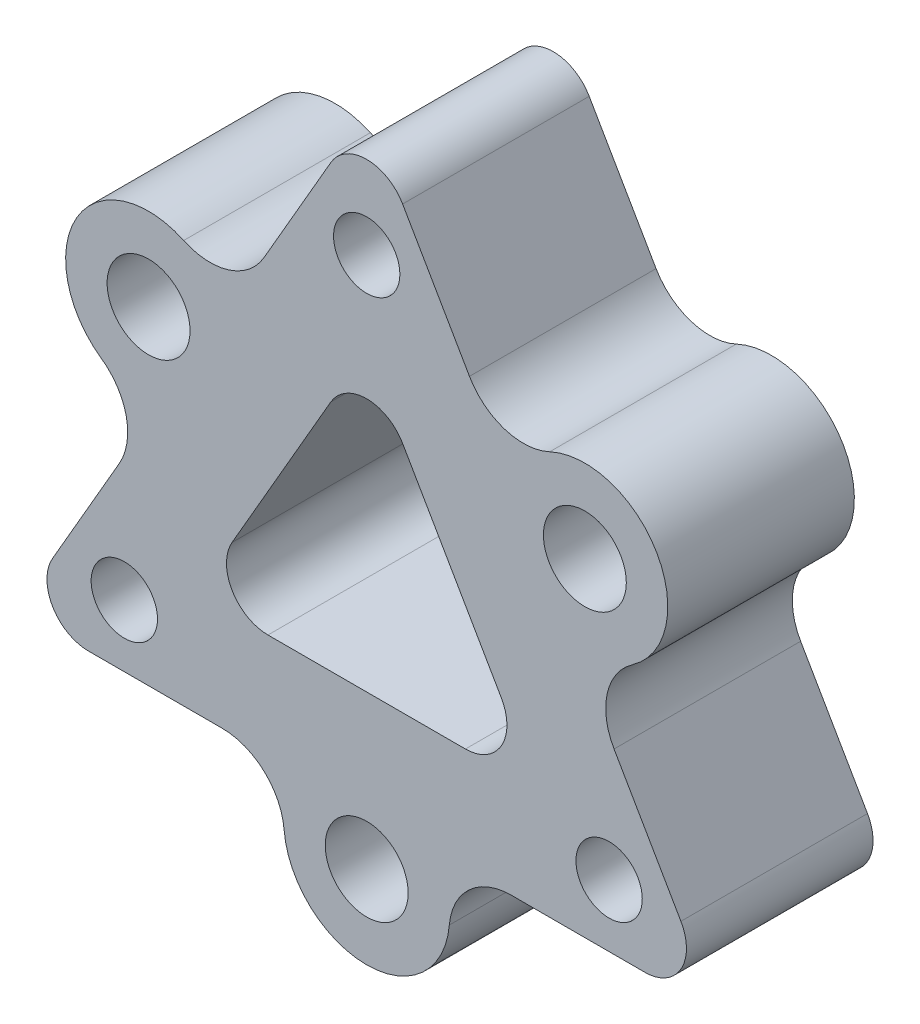
from build123d import *

# Parameters (mm, degrees)
SKETCH_1_R      = 1.6
EXTRUDE_1_DEPTH = 9
FILLET_1_R      = 2
SKETCH_2_R      = 4
SKETCH_2_R_2    = 2
EXTRUDE_2_DEPTH = 9
FILLET_2_R      = 3


with BuildPart() as part:
    # 草图1 → 凸台-拉伸1 (new body)
    with BuildSketch(Plane.XY):
        Polygon((0, 19.5), (-16.887495374, -9.75), (16.887495374, -9.75), align=None)
        with Locations((0, 13.5)):
            Circle(SKETCH_1_R, mode=Mode.SUBTRACT)
        with Locations((11.691342951, -6.75)):
            Circle(SKETCH_1_R, mode=Mode.SUBTRACT)
        with Locations((-11.691342951, -6.75)):
            Circle(SKETCH_1_R, mode=Mode.SUBTRACT)
        Polygon((8.227241336, -4.75), (0, 9.5), (-8.227241336, -4.75), align=None, mode=Mode.SUBTRACT)
    extrude(amount=EXTRUDE_1_DEPTH)

    # 圆角1
    fillet_1_edges = [part.edges().sort_by_distance(p)[0] for p in [
        (-8.227241336, -4.75, 4.5),
        (8.227241336, -4.75, 4.5),
        (0, 9.5, 4.5),
        (16.887495374, -9.75, 4.5),
        (-16.887495374, -9.75, 4.5),
        (0, 19.5, 4.5),
    ]]
    fillet(fillet_1_edges, radius=FILLET_1_R)

    # 草图2 → 凸台-拉伸2 (add)
    # profile 1 of 3: a face of its own
    with BuildSketch(Plane.XY.offset(9)):
        with Locations((10.522208656, 6.075)):
            Circle(SKETCH_2_R)
        with Locations((10.522208656, 6.075)):
            Circle(SKETCH_2_R_2, mode=Mode.SUBTRACT)
    # profile 2 of 3: a face of its own
    with BuildSketch(Plane.XY.offset(9)):
        with Locations((-10.522208656, 6.075)):
            Circle(SKETCH_2_R)
        with Locations((-10.522208656, 6.075)):
            Circle(SKETCH_2_R_2, mode=Mode.SUBTRACT)
    # profile 3 of 3: a face of its own
    with BuildSketch(Plane.XY.offset(9)):
        with Locations((0, -12.15)):
            Circle(SKETCH_2_R)
        with Locations((0, -12.15)):
            Circle(SKETCH_2_R_2, mode=Mode.SUBTRACT)
    extrude(amount=-EXTRUDE_2_DEPTH)

    # 圆角2
    fillet_2_edges = [part.edges().sort_by_distance(p)[0] for p in [
        (3.2, -9.75, 4.5),
        (-3.2, -9.75, 4.5),
        (6.843747687, 7.646281292, 4.5),
        (10.043747687, 2.103718708, 4.5),
        (-10.043747687, 2.103718708, 4.5),
        (-6.843747687, 7.646281292, 4.5),
    ]]
    fillet(fillet_2_edges, radius=FILLET_2_R)


solid = part.part
